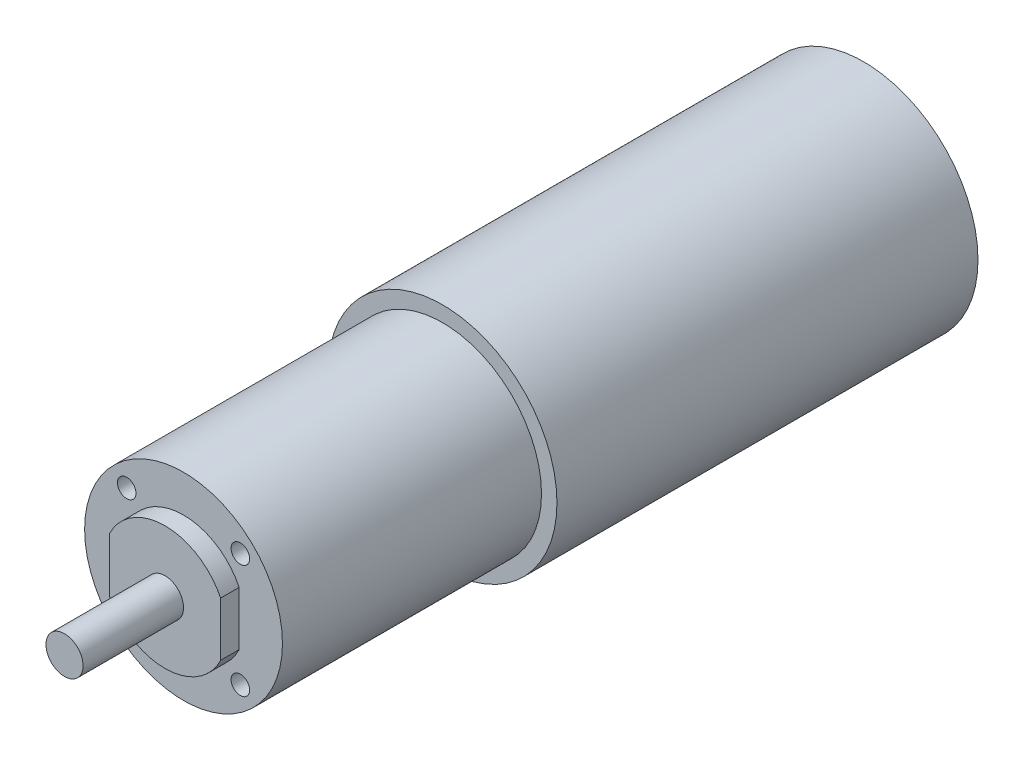
from build123d import *

# Parameters (mm, degrees)
SKETCH1_R           = 16
BOSS_EXTRUDE1_DEPTH = 41.9
SKETCH2_R           = 1.5
CUT_EXTRUDE1_DEPTH  = 5
BOSS_EXTRUDE2_DEPTH = 3
SKETCH4_R           = 3
BOSS_EXTRUDE3_DEPTH = 16.25
SKETCH5_R           = 18.5
BOSS_EXTRUDE4_DEPTH = 68.1


with BuildPart() as part:
    # Sketch1 → Boss-Extrude1 (new body)
    with BuildSketch(Plane.XY):
        Circle(SKETCH1_R)
    extrude(amount=BOSS_EXTRUDE1_DEPTH)

    # Sketch2 → Cut-Extrude1 (cut)
    with BuildSketch(Plane.XY.offset(41.9)):
        with Locations((-9.192388155, 9.192388155)):
            Circle(SKETCH2_R)
        with Locations((9.192388155, 9.192388155)):
            Circle(SKETCH2_R)
        with Locations((9.192388155, -9.192388155)):
            Circle(SKETCH2_R)
        with Locations((-9.192388155, -9.192388155)):
            Circle(SKETCH2_R)
    extrude(amount=-CUT_EXTRUDE1_DEPTH, mode=Mode.SUBTRACT)

    # Sketch3 → Boss-Extrude2 (add)
    with BuildSketch(Plane.XY.offset(41.9)):
        with BuildLine():
            Line((9, 4.358898944), (9, -4.358898944))
            ThreePointArc((9, -4.358898944), (0, -10), (-9, -4.358898944))
            Line((-9, -4.358898944), (-9, 4.358898944))
            ThreePointArc((-9, 4.358898944), (0, 10), (9, 4.358898944))
        make_face()
    extrude(amount=BOSS_EXTRUDE2_DEPTH)

    # Sketch4 → Boss-Extrude3 (add)
    with BuildSketch(Plane.XY.offset(44.9)):
        Circle(SKETCH4_R)
    extrude(amount=BOSS_EXTRUDE3_DEPTH)

    # Sketch5 → Boss-Extrude4 (add)
    with BuildSketch(Plane(origin=(0, 0, 0), x_dir=(-1, 0, 0), z_dir=(0, 0, -1))):
        Circle(SKETCH5_R)
    extrude(amount=BOSS_EXTRUDE4_DEPTH)


solid = part.part
